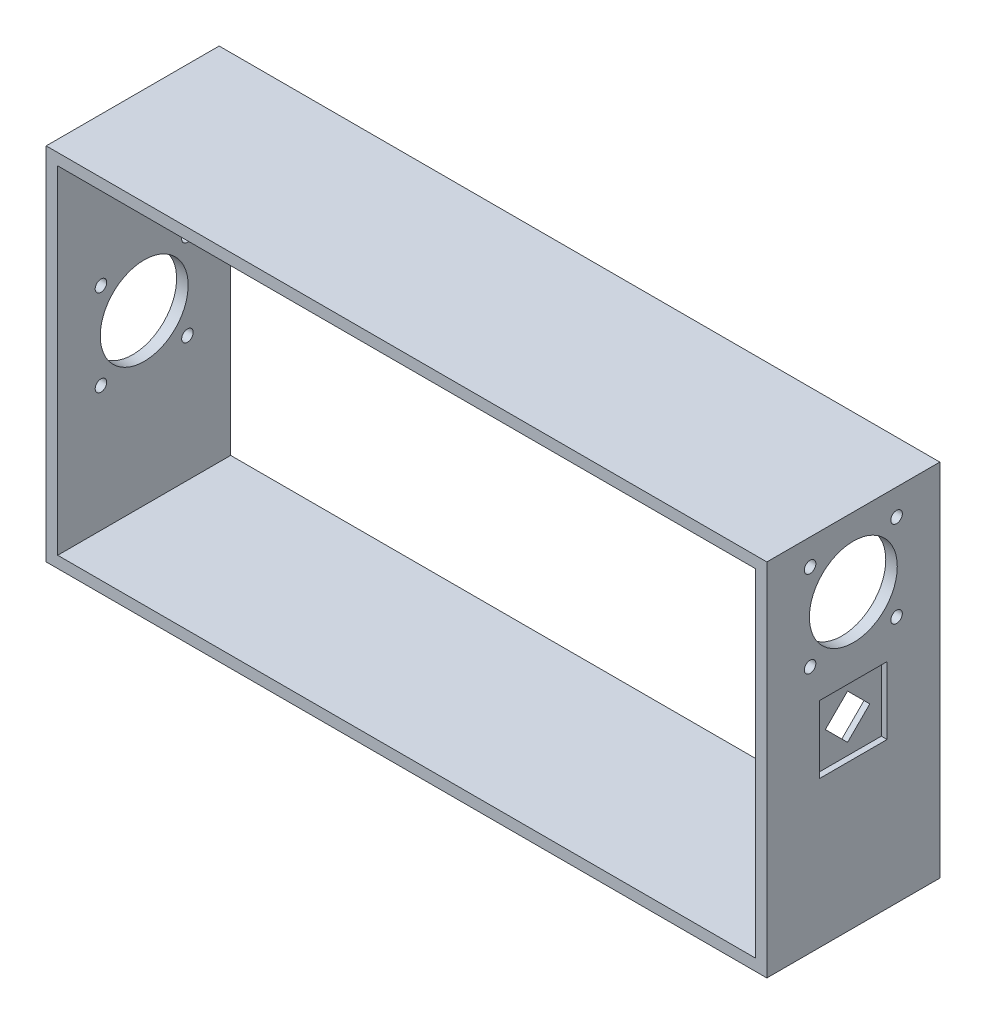
from build123d import *

# Parameters (mm, degrees)
SKIZZE1_W                       = 250
SKIZZE1_H                       = 125
SKIZZE1_W_2                     = 242
SKIZZE1_H_2                     = 117
AUFSATZ_LINEAR_AUSTRAGEN1_DEPTH = 60
SKIZZE2_R                       = 15.25
SKIZZE2_R_2                     = 2
SCHNITT_LINEAR_AUSTRAGEN1_DEPTH = 10
SKIZZE8_R                       = 15.25
SKIZZE8_R_2                     = 2
SCHNITT_LINEAR_AUSTRAGEN6_DEPTH = 22
SKIZZE10_W                      = 23.41492783
SKIZZE10_H                      = 23.41492783
SCHNITT_LINEAR_AUSTRAGEN7_DEPTH = 2


with BuildPart() as part:
    # Skizze1 → Aufsatz-Linear austragen1 (new body)
    with BuildSketch(Plane.XY):
        with Locations((125, 62.5)):
            Rectangle(SKIZZE1_W, SKIZZE1_H)
        with Locations((125, 62.5)):
            Rectangle(SKIZZE1_W_2, SKIZZE1_H_2, mode=Mode.SUBTRACT)
    extrude(amount=AUFSATZ_LINEAR_AUSTRAGEN1_DEPTH)

    # Skizze2 → Schnitt-Linear austragen1 (cut)
    with BuildSketch(Plane.ZY):
        with Locations((30, 62.5)):
            Circle(SKIZZE2_R)
        with Locations((15, 77.5)):
            Circle(SKIZZE2_R_2)
        with Locations((45, 77.5)):
            Circle(SKIZZE2_R_2)
        with Locations((45, 47.5)):
            Circle(SKIZZE2_R_2)
        with Locations((15, 47.5)):
            Circle(SKIZZE2_R_2)
    extrude(amount=-SCHNITT_LINEAR_AUSTRAGEN1_DEPTH, mode=Mode.SUBTRACT)

    # Skizze8 → Schnitt-Linear austragen6 (cut)
    with BuildSketch(Plane(origin=(250, 0, 0), x_dir=(0, 0, -1), z_dir=(1, 0, 0))):
        with Locations((-30, 101)):
            Circle(SKIZZE8_R)
        with Locations((-45, 116)):
            Circle(SKIZZE8_R_2)
        with Locations((-15, 86)):
            Circle(SKIZZE8_R_2)
        with Locations((-45, 86)):
            Circle(SKIZZE8_R_2)
        with Locations((-15, 116)):
            Circle(SKIZZE8_R_2)
        Polygon((-30, 70.207463915), (-37.707463915, 62.5), (-30, 54.792536085), (-22.292536085, 62.5), align=None)
    extrude(amount=-SCHNITT_LINEAR_AUSTRAGEN6_DEPTH, mode=Mode.SUBTRACT)

    # Skizze10 → Schnitt-Linear austragen7 (cut)
    with BuildSketch(Plane(origin=(250, 0, 0), x_dir=(0, 0, -1), z_dir=(1, 0, 0))):
        with Locations((-30, 62.5)):
            Rectangle(SKIZZE10_W, SKIZZE10_H)
    extrude(amount=-SCHNITT_LINEAR_AUSTRAGEN7_DEPTH, mode=Mode.SUBTRACT)


solid = part.part
